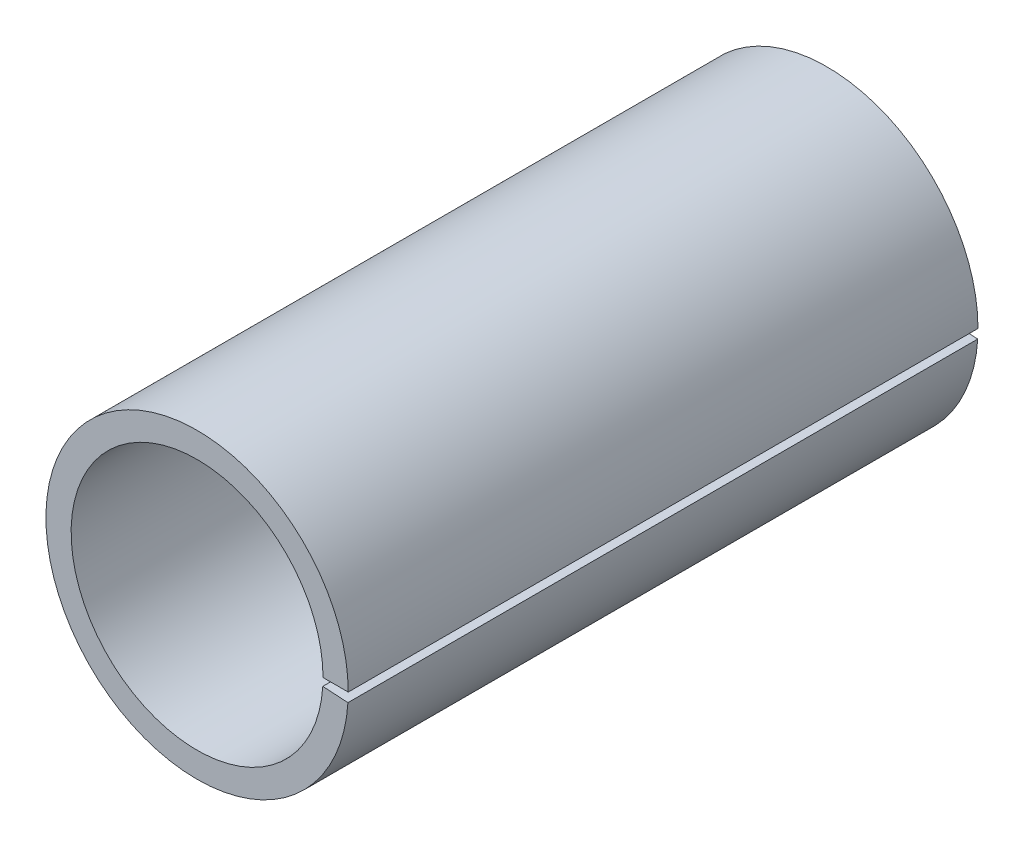
from build123d import *

# Parameters (mm, degrees)
SKETCH_1_R          = 6
SKETCH_1_R_2        = 5
EXTRUDE_1_DEPTH     = 25
CUT_EXTRUDE_START   = -30
CUT_EXTRUDE_1_DEPTH = 30


with BuildPart() as part:
    # 草图1 → 凸台-拉伸1 (new body)
    with BuildSketch(Plane.XY):
        Circle(SKETCH_1_R)
        Circle(SKETCH_1_R_2, mode=Mode.SUBTRACT)
    extrude(amount=EXTRUDE_1_DEPTH)

    # 草图2 → 切除-拉伸1 (cut)
    with BuildSketch(Plane.XY.offset(25).offset(CUT_EXTRUDE_START)):
        with BuildLine():
            Line((0, 0), (6, 0))
            ThreePointArc((6, 0), (5.99716252, -0.184503952), (5.988652764, -0.368833396))
            Line((5.988652764, -0.368833396), (0, 0))
        make_face()
    extrude(amount=CUT_EXTRUDE_1_DEPTH, mode=Mode.SUBTRACT)


solid = part.part
